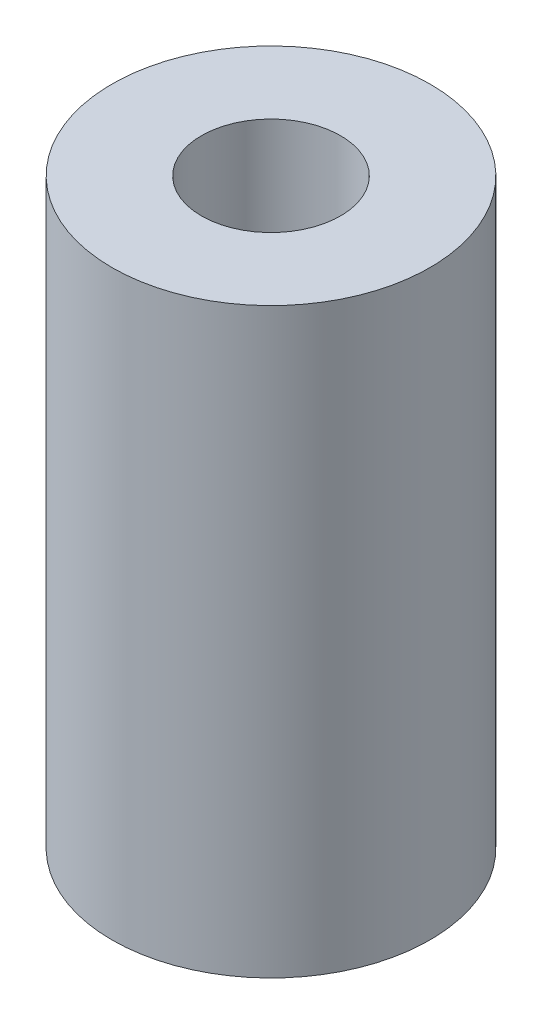
from build123d import *

# Parameters (mm, degrees)
SKETCH_1_R      = 4
SKETCH_1_R_2    = 1.75
EXTRUDE_1_DEPTH = 14.65


with BuildPart() as part:
    # 草图1 → 凸台-拉伸1 (new body)
    with BuildSketch(Plane(origin=(0, 0, 0), x_dir=(1, 0, 0), z_dir=(0, 1, 0))):
        with Locations(Location((0, 0, 0), (0, 0, 270))):
            Circle(SKETCH_1_R)
        with Locations(Location((0, 0, 0), (0, 0, 270))):
            Circle(SKETCH_1_R_2, mode=Mode.SUBTRACT)
    extrude(amount=EXTRUDE_1_DEPTH)


solid = part.part
